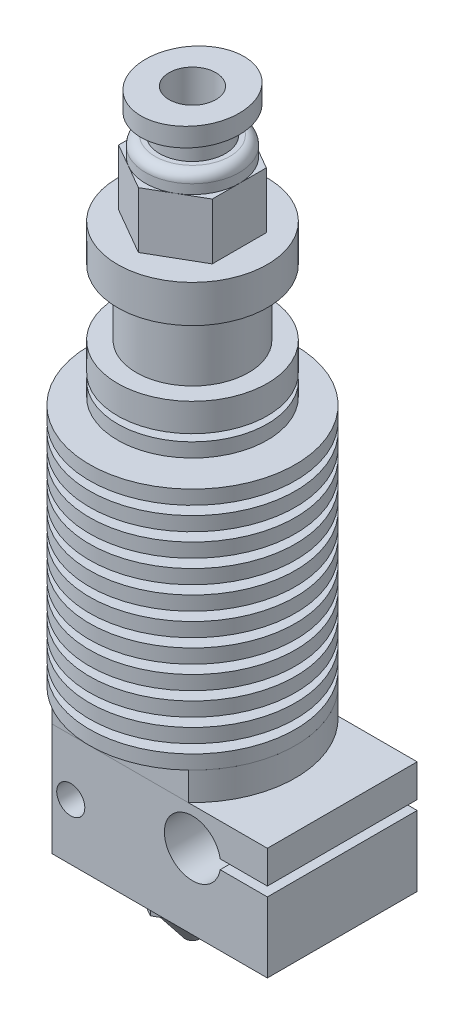
from build123d import *

# Parameters (mm, degrees)
CROQUIS3_R               = 6
SALIENTE_EXTRUIR1_DEPTH  = 28
SALIENTE_EXTRUIR1_DRAFT  = -2
CROQUIS4_R               = 4.5
CORTAR_EXTRUIR1_DEPTH    = 11
CROQUIS5_R               = 2.5
CORTAR_EXTRUIR2_DEPTH    = 36.580893749
CROQUIS6_R               = 3.5
CORTAR_EXTRUIR3_DEPTH    = 29
CROQUIS13_R              = 4
SALIENTE_EXTRUIR6_DEPTH  = 3
CROQUIS7_W               = 23
CROQUIS7_H               = 12
SALIENTE_EXTRUIR2_DEPTH  = 8
CROQUIS8_R               = 1.5
CORTAR_EXTRUIR4_DEPTH    = 64.095166217
CROQUIS9_R               = 3
CORTAR_EXTRUIR5_DEPTH    = 50.929950931
SALIENTE_EXTRUIR3_DEPTH  = 4
CROQUIS11_R              = 3.897114317
SALIENTE_EXTRUIR4_DEPTH  = 4
SALIENTE_EXTRUIR4_TAPER  = 38
SALIENTE_EXTRUIR5_DEPTH  = 6
CROQUIS14_R              = 5.001296707
SALIENTE_EXTRUIR7_DEPTH  = 2
REDONDEO4_R              = 1
CROQUIS15_R              = 3.501296707
SALIENTE_EXTRUIR8_DEPTH  = 1.5
CROQUIS16_R              = 2.634186306
SALIENTE_EXTRUIR9_DEPTH  = 1
CROQUIS17_RX             = 5.5
CROQUIS17_RY             = 5
SALIENTE_EXTRUIR10_DEPTH = 2
CROQUIS18_R              = 2.5
CORTAR_EXTRUIR6_DEPTH    = 14
CROQUIS19_R              = 0.75
CORTAR_EXTRUIR7_DEPTH    = 10


with BuildPart() as part:
    # Croquis1 → Revolución1 (revolve)
    with BuildSketch(Plane.XY):
        Polygon((0, 0), (-8, 0), (-8, -4), (-6, -4), (-6, -11), (-8, -11), (-8, -14), (-5, -14), (-5, -14.75), (-8, -14.75), (-8, -16.25), (-5, -16.25), (-5, -17), (-11, -17), (-11, -18.5), (-5, -18.5), (-5, -19.45), (-11, -19.45), (-11, -20.95), (-5, -20.95), (-5, -21.9), (-11, -21.9), (-11, -23.4), (-5, -23.4), (-5, -24.35), (-11, -24.35), (-11, -25.85), (-5, -25.85), (-5, -26.8), (-11, -26.8), (-11, -28.3), (-5, -28.3), (-5, -29.25), (-11, -29.25), (-11, -30.75), (-5, -30.75), (-5, -31.7), (-11, -31.7), (-11, -33.2), (-5, -33.2), (-5, -34.15), (-11, -34.15), (-11, -35.65), (-5, -35.65), (-5, -36.6), (-11, -36.6), (-11, -38.1), (-5, -38.1), (-5, -39.05), (-11, -39.05), (-11, -40.55), (-5, -40.55), (-5, -41.5), (-11, -41.5), (-11, -43), (0, -43), align=None)
    revolve(axis=Axis((0, 0, 0), (0, -1, 0)))


with BuildPart() as saliente_extruir1_tool:
    # Croquis3 → Saliente-Extruir1 (with draft: the straight prism first)
    with BuildSketch(Plane.XZ.offset(43)):
        with Locations(Location((0, 0, 0), (0, 0, 180))):
            Circle(CROQUIS3_R)
    extrude(amount=-SALIENTE_EXTRUIR1_DEPTH)
    # Saliente-Extruir1: the draft: its side faces are tilted about the plane it starts from
    saliente_extruir1_sides = [saliente_extruir1_tool.faces().sort_by_distance(p)[0] for p in [
        (6, -29, 0),
    ]]
    draft(saliente_extruir1_sides, Plane.XZ.offset(43), SALIENTE_EXTRUIR1_DRAFT)


with BuildPart() as part_1:
    add(part.part)

    # Saliente-Extruir1: add saliente_extruir1_tool
    add(saliente_extruir1_tool.part)

    # Croquis4 → Cortar-Extruir1 (cut)
    with BuildSketch(Plane(origin=(0, 0, 0), x_dir=(1, 0, 0), z_dir=(0, 1, 0))):
        with Locations(Location((0, 0, 0), (0, 0, 180))):
            Circle(CROQUIS4_R)
    extrude(amount=-CORTAR_EXTRUIR1_DEPTH, mode=Mode.SUBTRACT)

    # Croquis5 → Cortar-Extruir2 (cut, through all)
    with BuildSketch(Plane(origin=(0, -11, 0), x_dir=(1, 0, 0), z_dir=(0, 1, 0))):
        with Locations(Location((0, 0, 0), (0, 0, 180))):
            Circle(CROQUIS5_R)
    extrude(amount=-CORTAR_EXTRUIR2_DEPTH, mode=Mode.SUBTRACT)

    # Croquis6 → Cortar-Extruir3 (cut)
    with BuildSketch(Plane.XZ.offset(43)):
        Circle(CROQUIS6_R)
    extrude(amount=-CORTAR_EXTRUIR3_DEPTH, mode=Mode.SUBTRACT)


with BuildPart() as body_2:
    # Croquis13 → Saliente-Extruir6 (new body)
    with BuildSketch(Plane.XZ.offset(43)):
        with BuildLine():
            Line((-7, 8), (7.549834435, 8))
            ThreePointArc((7.549834435, 8), (11, 0), (7.549834435, -8))
            Line((7.549834435, -8), (-7, -8))
            Line((-7, -8), (-7, 8))
        make_face()
        Circle(CROQUIS13_R, mode=Mode.SUBTRACT)
    extrude(amount=SALIENTE_EXTRUIR6_DEPTH)


with BuildPart() as body_3:
    # Croquis7 → Saliente-Extruir2 (new, symmetric)
    with BuildSketch(Plane.XY):
        with Locations((4.5, -52)):
            Rectangle(CROQUIS7_W, CROQUIS7_H)
    extrude(amount=SALIENTE_EXTRUIR2_DEPTH, both=True)

    # Croquis8 → Cortar-Extruir4 (cut, through all)
    with BuildSketch(Plane.XY.offset(8)):
        with Locations((-5, -52)):
            Circle(CROQUIS8_R)
        with BuildLine():
            Line((10.958039892, -49.5), (16, -49.5))
            Line((16, -49.5), (16, -50.5))
            Line((16, -50.5), (10.958039892, -50.5))
            ThreePointArc((10.958039892, -50.5), (5, -50), (10.958039892, -49.5))
        make_face()
    extrude(amount=-CORTAR_EXTRUIR4_DEPTH, mode=Mode.SUBTRACT)

    # Croquis9 → Cortar-Extruir5 (cut, through all)
    with BuildSketch(Plane(origin=(0, -46, 0), x_dir=(1, 0, 0), z_dir=(0, 1, 0))):
        with Locations(Location((0, 0, 0), (0, 0, 270))):
            Circle(CROQUIS9_R)
    extrude(amount=-CORTAR_EXTRUIR5_DEPTH, mode=Mode.SUBTRACT)


with BuildPart() as body_4:
    # Croquis10 → Saliente-Extruir3 (new body)
    with BuildSketch(Plane.XZ.offset(58)):
        Polygon((0, 4.5), (-3.897114317, 2.25), (-3.897114317, -2.25), (0, -4.5), (3.897114317, -2.25), (3.897114317, 2.25), align=None)
    extrude(amount=SALIENTE_EXTRUIR3_DEPTH)

    # Croquis11 → Saliente-Extruir4 (add)
    with BuildSketch(Plane.XZ.offset(62)):
        Circle(CROQUIS11_R)
    extrude(amount=SALIENTE_EXTRUIR4_DEPTH, taper=SALIENTE_EXTRUIR4_TAPER)

    # Croquis19 → Cortar-Extruir7 (cut)
    with BuildSketch(Plane.XZ.offset(66)):
        with Locations(Location((0, 0, 0), (0, 0, 270))):
            Circle(CROQUIS19_R)
    extrude(amount=-CORTAR_EXTRUIR7_DEPTH, mode=Mode.SUBTRACT)


with BuildPart() as body_5:
    # Croquis12 → Saliente-Extruir5 (new body)
    with BuildSketch(Plane(origin=(0, 0, 0), x_dir=(1, 0, 0), z_dir=(0, 1, 0))):
        Polygon((0, 5.775), (-5.001296707, 2.8875), (-5.001296707, -2.8875), (0, -5.775), (5.001296707, -2.8875), (5.001296707, 2.8875), align=None)
    extrude(amount=SALIENTE_EXTRUIR5_DEPTH)

    # Croquis14 → Saliente-Extruir7 (add)
    with BuildSketch(Plane(origin=(0, 6, 0), x_dir=(1, 0, 0), z_dir=(0, 1, 0))):
        with Locations(Location((0, 0, 0), (0, 0, 180))):
            Circle(CROQUIS14_R)
    extrude(amount=SALIENTE_EXTRUIR7_DEPTH)

    # Redondeo4
    redondeo4_edges = [body_5.edges().sort_by_distance(p)[0] for p in [
        (5.001296707, 8, 0),
    ]]
    fillet(redondeo4_edges, radius=REDONDEO4_R)

    # Croquis15 → Saliente-Extruir8 (add)
    with BuildSketch(Plane(origin=(0, 8, 0), x_dir=(1, 0, 0), z_dir=(0, 1, 0))):
        with Locations(Location((0, 0, 0), (0, 0, 180))):
            Circle(CROQUIS15_R)
    extrude(amount=SALIENTE_EXTRUIR8_DEPTH)

    # Croquis16 → Saliente-Extruir9 (add)
    with BuildSketch(Plane(origin=(0, 9.5, 0), x_dir=(1, 0, 0), z_dir=(0, 1, 0))):
        with Locations(Location((0, 0, 0), (0, 0, 180))):
            Circle(CROQUIS16_R)
    extrude(amount=SALIENTE_EXTRUIR9_DEPTH)

    # Croquis17 → Saliente-Extruir10 (add)
    with BuildSketch(Plane(origin=(0, 10.5, 0), x_dir=(1, 0, 0), z_dir=(0, 1, 0))):
        with Locations(Location((0, 0), (0, 0, -90))):
            Ellipse(CROQUIS17_RX, CROQUIS17_RY)
    extrude(amount=SALIENTE_EXTRUIR10_DEPTH)

    # Croquis18 → Cortar-Extruir6 (cut)
    with BuildSketch(Plane(origin=(0, 12.5, 0), x_dir=(1, 0, 0), z_dir=(0, 1, 0))):
        with Locations(Location((0, 0, 0), (0, 0, 180))):
            Circle(CROQUIS18_R)
    extrude(amount=-CORTAR_EXTRUIR6_DEPTH, mode=Mode.SUBTRACT)


solid = Compound([part_1.part, body_2.part, body_3.part, body_4.part, body_5.part])
